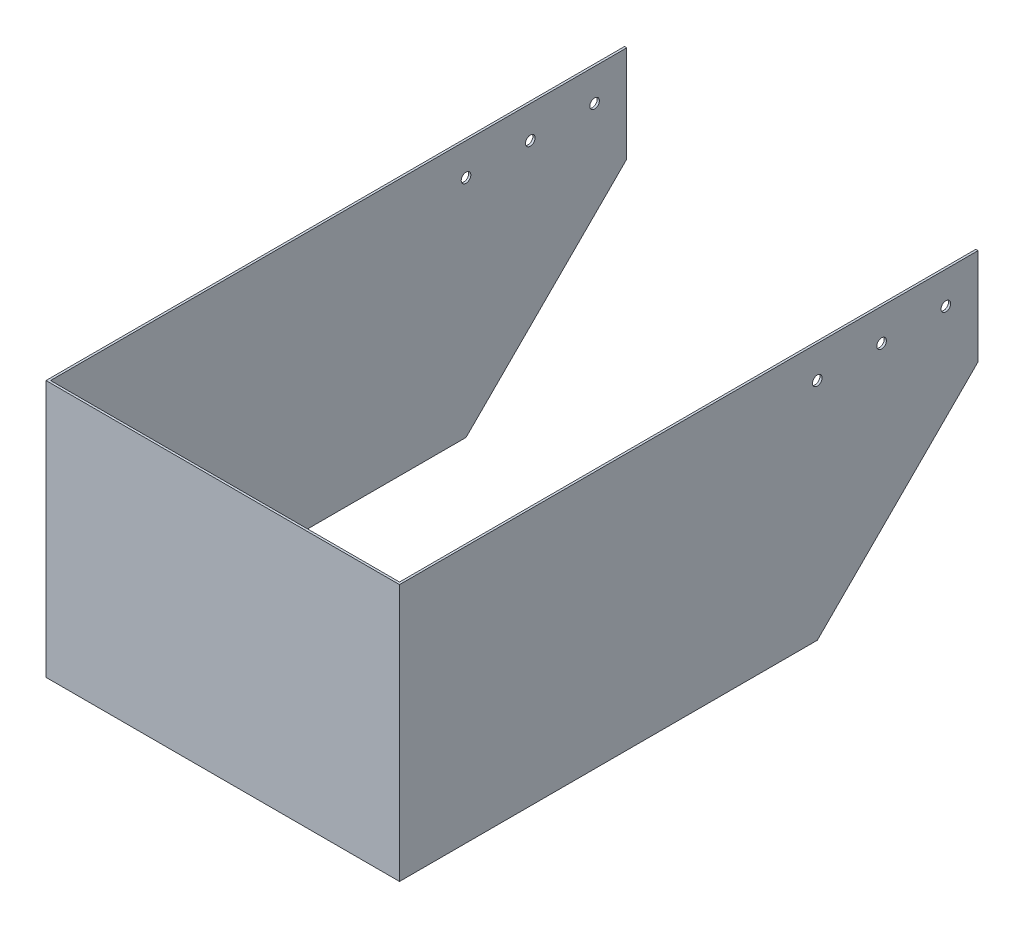
from build123d import *

# Parameters (mm, degrees)
SKETCH1_W           = 110
SKETCH1_H           = 180
BOSS_EXTRUDE1_DEPTH = 80
SKETCH2_W           = 108.6
SKETCH2_H           = 179.3
CUT_EXTRUDE1_DEPTH  = 226.610283454
SKETCH4_R           = 1.5
CUT_EXTRUDE3_DEPTH  = 226.610283454
CUT_EXTRUDE5_DEPTH  = 226.610283454


with BuildPart() as part:
    # Sketch1 → Boss-Extrude1 (new body)
    with BuildSketch(Plane(origin=(0, 0, 0), x_dir=(1, 0, 0), z_dir=(0, 1, 0))):
        with Locations((55, 90)):
            Rectangle(SKETCH1_W, SKETCH1_H)
    extrude(amount=BOSS_EXTRUDE1_DEPTH)

    # Sketch2 → Cut-Extrude1 (cut, through all)
    with BuildSketch(Plane(origin=(0, 80, 0), x_dir=(1, 0, 0), z_dir=(0, 1, 0))):
        with Locations((55, 90.35)):
            Rectangle(SKETCH2_W, SKETCH2_H)
    extrude(amount=-CUT_EXTRUDE1_DEPTH, mode=Mode.SUBTRACT)

    # Sketch4 → Cut-Extrude3 (cut, through all)
    with BuildSketch(Plane(origin=(110, 0, 0), x_dir=(0, 0, -1), z_dir=(1, 0, 0))):
        with Locations((170, 70)):
            Circle(SKETCH4_R)
        with Locations((130, 70)):
            Circle(SKETCH4_R)
        with Locations((150, 70)):
            Circle(SKETCH4_R)
    extrude(amount=-CUT_EXTRUDE3_DEPTH, mode=Mode.SUBTRACT)

    # Sketch8 → Cut-Extrude5 (cut, through all)
    with BuildSketch(Plane(origin=(110, 0, 0), x_dir=(0, 0, -1), z_dir=(1, 0, 0))):
        Polygon((180, 50), (130, 0), (180, 0), align=None)
    extrude(amount=-CUT_EXTRUDE5_DEPTH, mode=Mode.SUBTRACT)


solid = part.part
